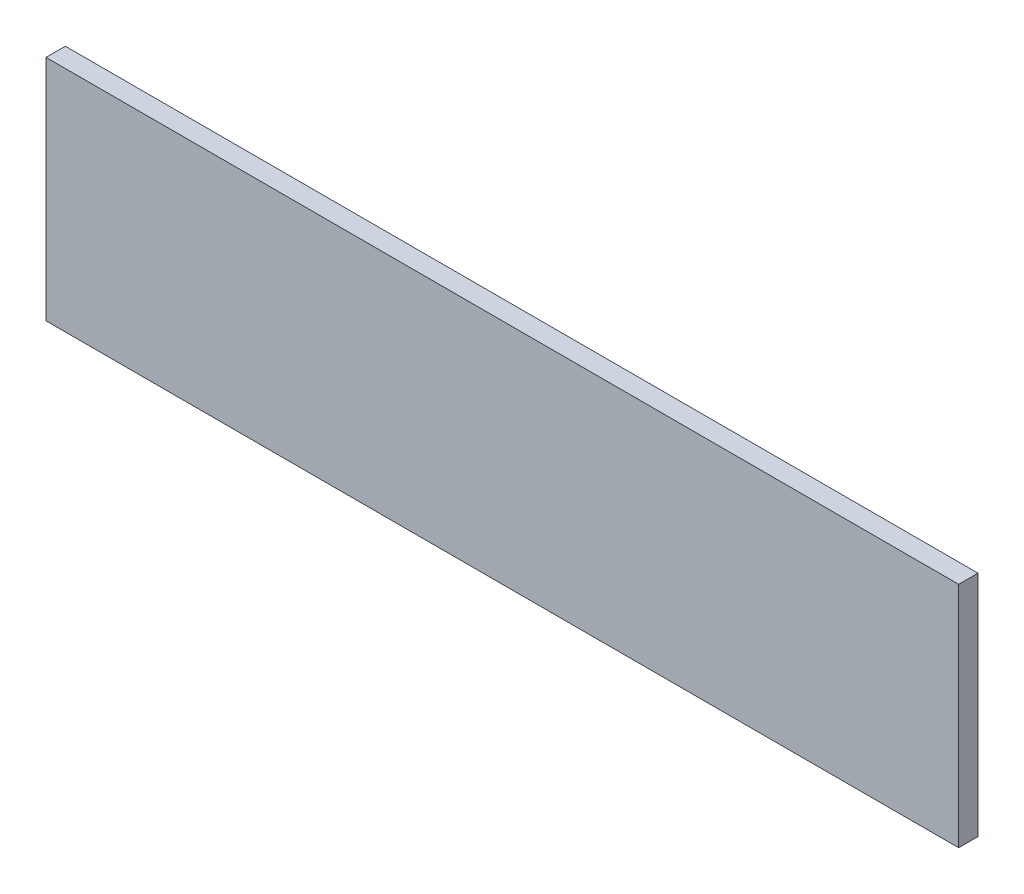
from build123d import *

# Parameters (mm, degrees)
CROQUIS1_W              = 600
CROQUIS1_H              = 150
SALIENTE_EXTRUIR1_DEPTH = 12.7


with BuildPart() as part:
    # Croquis1 → Saliente-Extruir1 (new body)
    with BuildSketch(Plane.XY):
        Rectangle(CROQUIS1_W, CROQUIS1_H)
    extrude(amount=SALIENTE_EXTRUIR1_DEPTH)


solid = part.part
